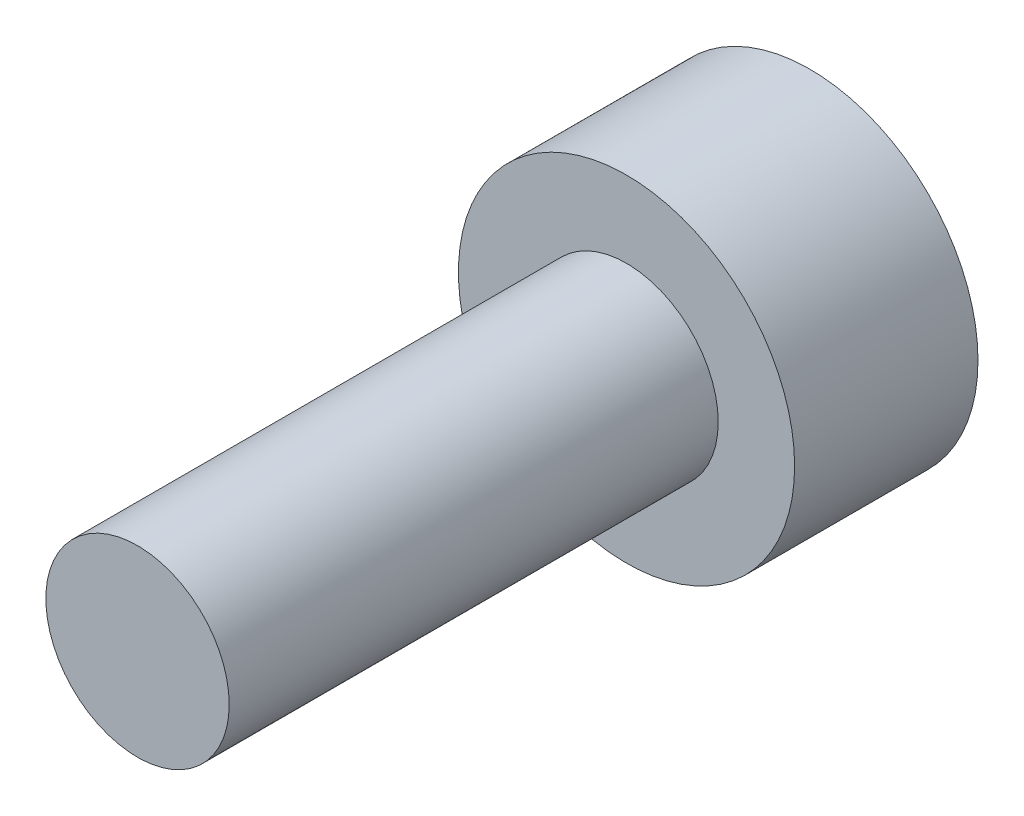
from build123d import *

# Parameters (mm, degrees)
SKETCH_1_R          = 2.75
EXTRUDE_1_DEPTH     = 3
SKETCH_2_R          = 1.5
EXTRUDE_2_DEPTH     = 8
CUT_EXTRUDE_1_DEPTH = 2


with BuildPart() as part:
    # ｽｹｯﾁ1 → ﾎﾞｽ - 押し出し1 (new body)
    with BuildSketch(Plane.XY):
        Circle(SKETCH_1_R)
    extrude(amount=EXTRUDE_1_DEPTH)

    # ｽｹｯﾁ2 → ﾎﾞｽ - 押し出し2 (add)
    with BuildSketch(Plane.XY.offset(3)):
        Circle(SKETCH_2_R)
    extrude(amount=EXTRUDE_2_DEPTH)

    # ｽｹｯﾁ3 → ｶｯﾄ - 押し出し1 (cut)
    with BuildSketch(Plane(origin=(0, 0, 0), x_dir=(-1, 0, 0), z_dir=(0, 0, -1))):
        Polygon((1.66357981, -0.399103763), (1.177423903, 1.241150495), (-0.486155907, 1.640254258), (-1.66357981, 0.399103763), (-1.177423903, -1.241150495), (0.486155907, -1.640254258), align=None)
    extrude(amount=-CUT_EXTRUDE_1_DEPTH, mode=Mode.SUBTRACT)


solid = part.part
